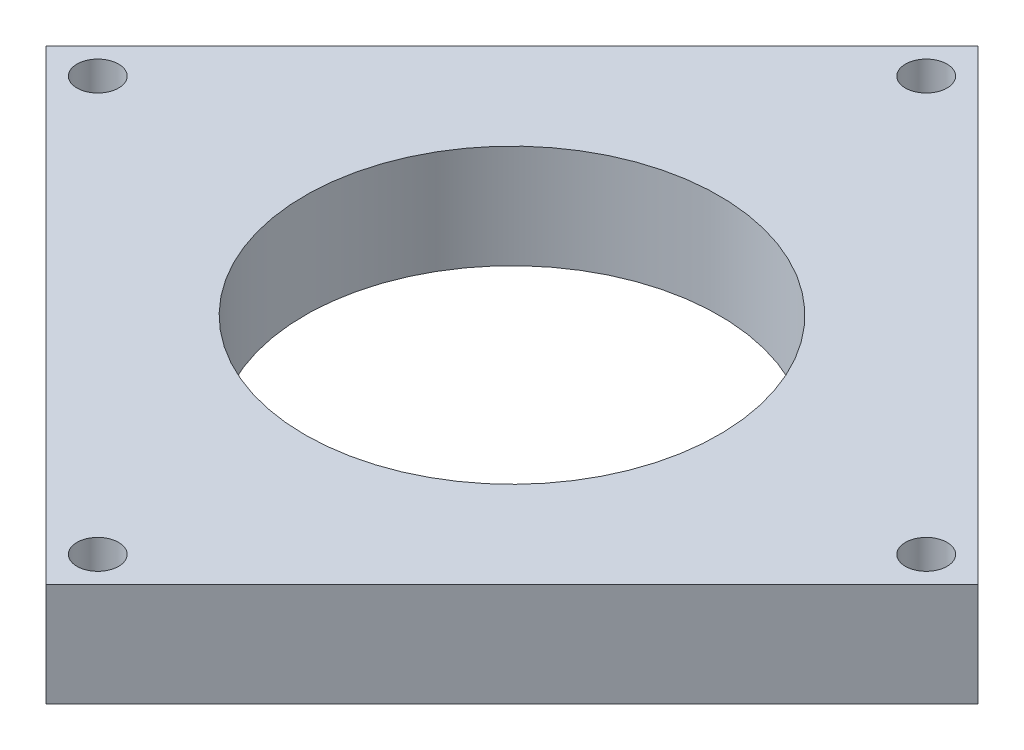
from build123d import *

# Parameters (mm, degrees)
BOSS_EXTRUDE1_DEPTH        = 12.7
SKETCH2_R                  = 25.4
CUT_EXTRUDE1_DEPTH         = 82.814026915
F_7_0_201_DIAMETER_HOLE1_D = 5.1054
CIRPATTERN1_COUNT          = 4


with BuildPart() as part:
    # Sketch1 → Boss-Extrude1 (new body)
    with BuildSketch(Plane(origin=(0, 0, 0), x_dir=(1, 0, 0), z_dir=(0, 1, 0))):
        Polygon((0, -57.15), (57.15, 0), (0, 57.15), (-57.15, 0), align=None)
    extrude(amount=BOSS_EXTRUDE1_DEPTH)

    # Sketch2 → Cut-Extrude1 (cut, through all)
    with BuildSketch(Plane(origin=(0, 12.7, 0), x_dir=(1, 0, 0), z_dir=(0, 1, 0))):
        with Locations(Location((0, 0, 0), (0, 0, 270))):
            Circle(SKETCH2_R)
    extrude(amount=-CUT_EXTRUDE1_DEPTH, mode=Mode.SUBTRACT)

    # #7 (0.201) Diameter Hole1 (through all)
    with Locations(Plane(origin=(0, 12.7, 0), x_dir=(-1, 0, 0), z_dir=(0, 1, 0))):
        with Locations((0, -50.8)):
            f_7_0_201_diameter_hole1 = Hole(F_7_0_201_DIAMETER_HOLE1_D / 2)

    # CirPattern1: #7 (0.201) Diameter Hole1 ×4 about axis
    cirpattern1_axis = Axis((0, 0, 0), (0, 1, 0))
    for i in range(1, CIRPATTERN1_COUNT):
        add(f_7_0_201_diameter_hole1.rotate(cirpattern1_axis, i * 360 / CIRPATTERN1_COUNT), mode=Mode.SUBTRACT)


solid = part.part
